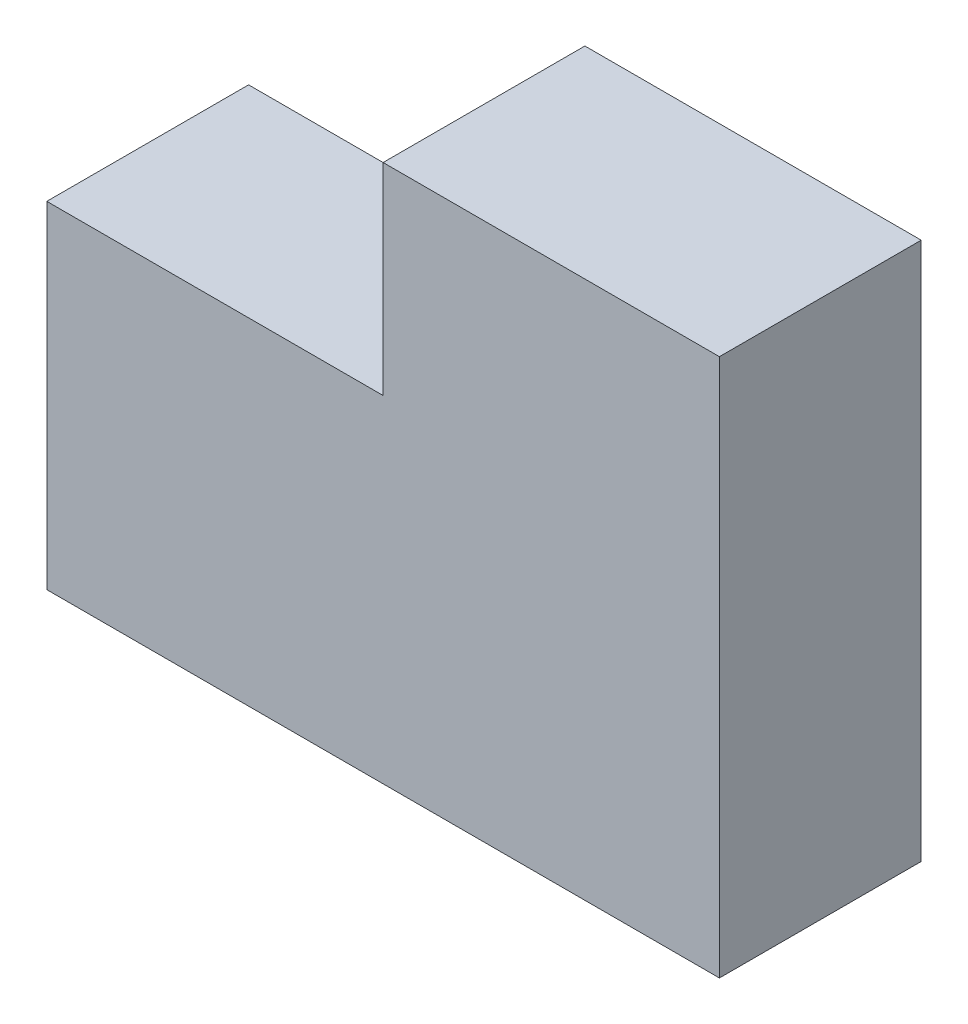
from build123d import *

# Parameters (mm, degrees)
SALIENTE_EXTRUIR1_DEPTH = 3


with BuildPart() as part:
    # Croquis1 → Saliente-Extruir1 (new body)
    with BuildSketch(Plane.XY):
        Polygon((0, 0), (10, 0), (10, 8), (5, 8), (5, 5), (0, 5), align=None)
    extrude(amount=SALIENTE_EXTRUIR1_DEPTH)


solid = part.part
